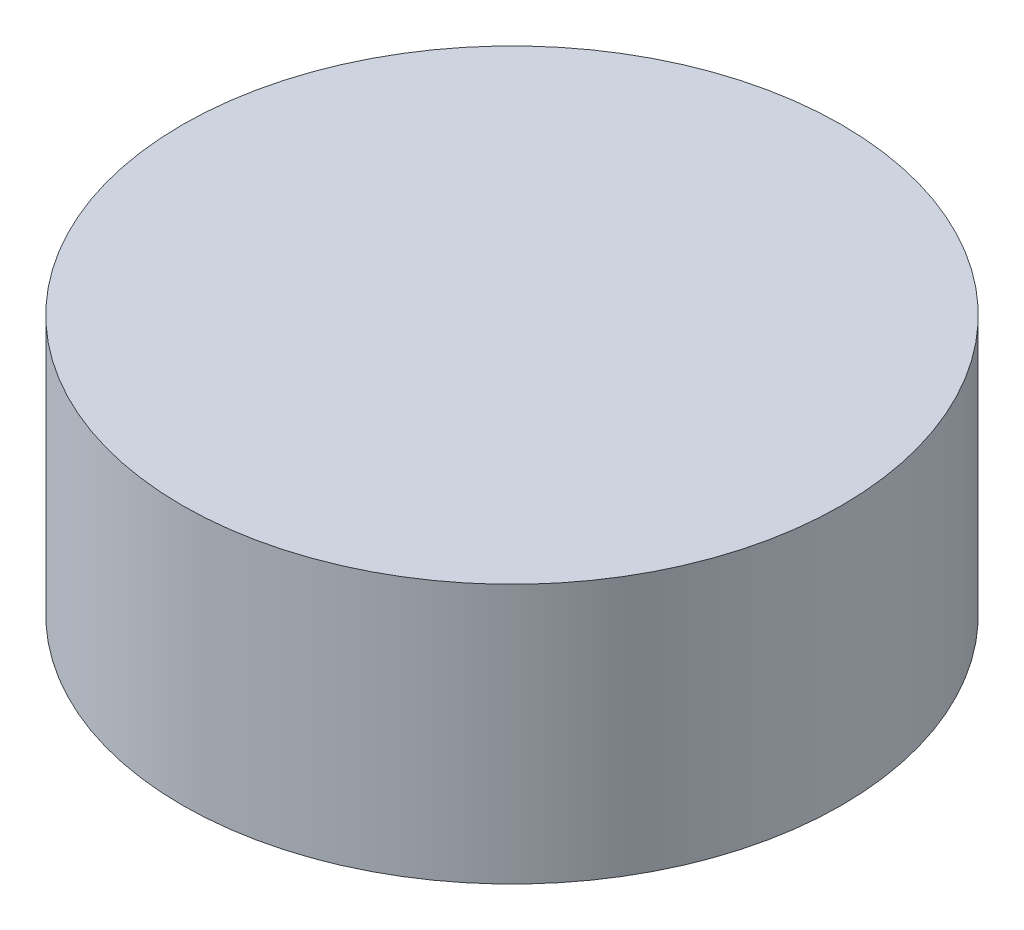
from build123d import *

# Parameters (mm, degrees)
SKETCH1_R           = 6.35
BOSS_EXTRUDE1_DEPTH = 5


with BuildPart() as part:
    # Sketch1 → Boss-Extrude1 (new body)
    with BuildSketch(Plane(origin=(0, 0, 0), x_dir=(1, 0, 0), z_dir=(0, 1, 0))):
        with Locations(Location((0, 0, 0), (0, 0, 270))):
            Circle(SKETCH1_R)
    extrude(amount=BOSS_EXTRUDE1_DEPTH)


solid = part.part
